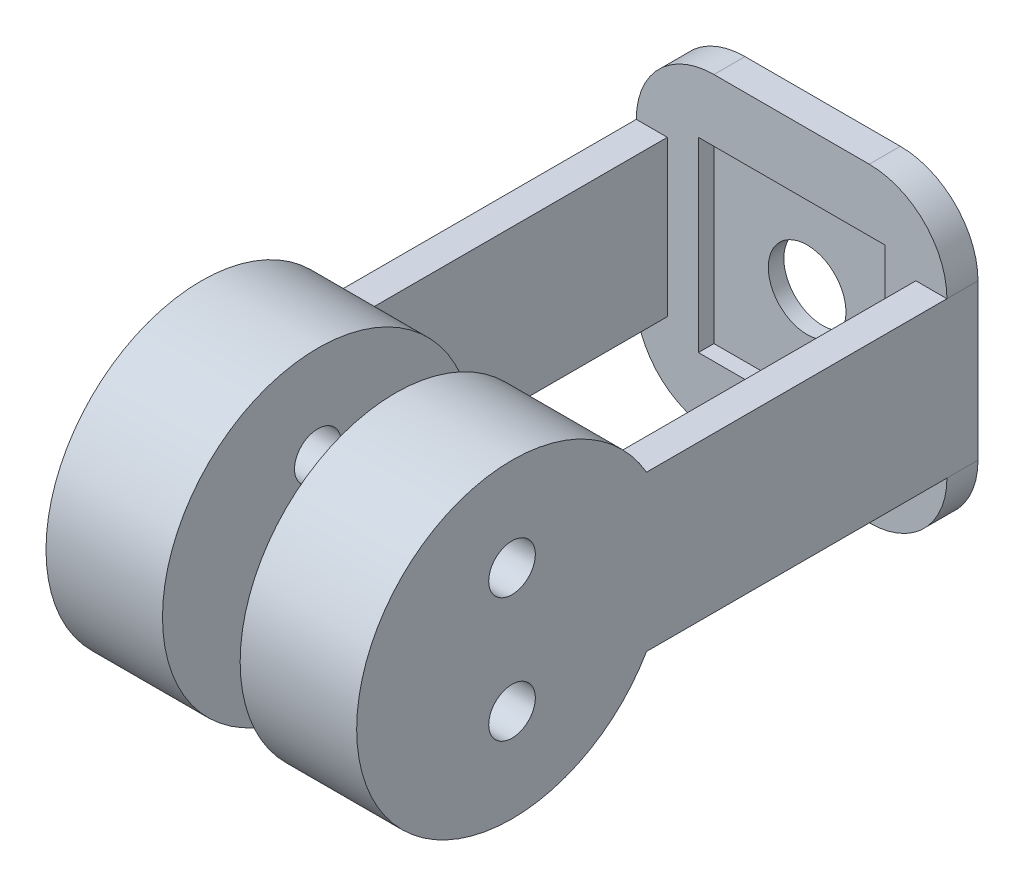
from build123d import *
from build123d.topology import SkipClean

# Parameters (mm, degrees)
SKETCH1_W           = 20
SKETCH1_H           = 20
BOSS_EXTRUDE1_DEPTH = 2
SKETCH3_R           = 2.5
CUT_EXTRUDE1_DEPTH  = 15.282857
SKETCH4_W           = 12
SKETCH4_H           = 12
CUT_EXTRUDE2_DEPTH  = 1
SKETCH5_W           = 2
SKETCH5_H           = 20
BOSS_EXTRUDE2_DEPTH = 38
CUT_EXTRUDE3_DEPTH  = 46.825757
SKETCH7_R           = 10
BOSS_EXTRUDE3_DEPTH = 7.5
BOSS_EXTRUDE4_START = -7.5
SKETCH8_R           = 10
BOSS_EXTRUDE4_DEPTH = 7.5
CUT_EXTRUDE4_DEPTH  = 46.825757
CUT_EXTRUDE5_DEPTH  = 46.825757
FILLET1_R           = 5
FILLET2_R           = 5
FILLET3_R           = 5
FILLET4_R           = 5


with BuildPart() as part:
    # Sketch1 → Boss-Extrude1 (new body)
    with BuildSketch(Plane.XY):
        Rectangle(SKETCH1_W, SKETCH1_H)
    extrude(amount=BOSS_EXTRUDE1_DEPTH)

    # Sketch3 → Cut-Extrude1 (cut, through all)
    with BuildSketch(Plane(origin=(0, 0, 0), x_dir=(-1, 0, 0), z_dir=(0, 0, -1))):
        Circle(SKETCH3_R)
    extrude(amount=-CUT_EXTRUDE1_DEPTH, mode=Mode.SUBTRACT)

    # Sketch4 → Cut-Extrude2 (cut)
    with BuildSketch(Plane.XY.offset(2)):
        Rectangle(SKETCH4_W, SKETCH4_H)
    extrude(amount=-CUT_EXTRUDE2_DEPTH, mode=Mode.SUBTRACT)

    # Sketch5 → Boss-Extrude2 (add)
    with BuildSketch(Plane.XY.offset(2)):
        with Locations((9, 0)):
            Rectangle(SKETCH5_W, SKETCH5_H)
        with Locations((-9, 0)):
            Rectangle(SKETCH5_W, SKETCH5_H)
    extrude(amount=BOSS_EXTRUDE2_DEPTH)

    # Sketch6 → Cut-Extrude3 (cut, through all)
    with BuildSketch(Plane.ZY.offset(10)):
        with BuildLine():
            Line((40, 10), (30, 10))
            ThreePointArc((30, 10), (37.071068, 7.071068), (40, 0))
            Line((40, 0), (40, 10))
        make_face()
        with BuildLine():
            Line((40, -10), (40, 0))
            ThreePointArc((40, 0), (37.071068, -7.071068), (30, -10))
            Line((30, -10), (40, -10))
        make_face()
    extrude(amount=-CUT_EXTRUDE3_DEPTH, mode=Mode.SUBTRACT)

    # Sketch7 → Boss-Extrude3 (add)
    with SkipClean():  # the faces are left unmerged after this step: merging them gives an invalid solid
        with BuildSketch(Plane.ZY.offset(10)):
            with Locations((30, 0)):
                Circle(SKETCH7_R)
        extrude(amount=-BOSS_EXTRUDE3_DEPTH)

    # Sketch8 → Boss-Extrude4 (add)
    with SkipClean():  # the faces are left unmerged after this step: merging them gives an invalid solid
        with BuildSketch(Plane(origin=(10, 0, 0), x_dir=(0, 0, -1), z_dir=(1, 0, 0)).offset(BOSS_EXTRUDE4_START)):
            with Locations(Location((-30, 0, 0), (0, 0, 180))):
                Circle(SKETCH8_R)
        extrude(amount=BOSS_EXTRUDE4_DEPTH)

    # Sketch9 → Cut-Extrude4 (cut, through all)
    with SkipClean():  # the faces are left unmerged after this step: merging them gives an invalid solid
        with BuildSketch(Plane.ZY.offset(10)):
            with BuildLine():
                ThreePointArc((31.5, 4), (31.06066, 5.06066), (30, 5.5))
                Line((30, 5.5), (30, 2.5))
                ThreePointArc((30, 2.5), (31.06066, 2.93934), (31.5, 4))
            make_face()
            with BuildLine():
                Line((30, 2.5), (30, 5.5))
                ThreePointArc((30, 5.5), (28.5, 4), (30, 2.5))
            make_face()
            with BuildLine():
                ThreePointArc((31.5, -4), (31.06066, -2.93934), (30, -2.5))
                Line((30, -2.5), (30, -5.5))
                ThreePointArc((30, -5.5), (31.06066, -5.06066), (31.5, -4))
            make_face()
            with BuildLine():
                Line((30, -5.5), (30, -2.5))
                ThreePointArc((30, -2.5), (28.5, -4), (30, -5.5))
            make_face()
        extrude(amount=-CUT_EXTRUDE4_DEPTH, mode=Mode.SUBTRACT)

    # Sketch11 → Cut-Extrude5 (cut, through all)
    with SkipClean():  # the faces are left unmerged after this step: merging them gives an invalid solid
        with BuildSketch(Plane(origin=(10, 0, 0), x_dir=(0, 0, -1), z_dir=(1, 0, 0))):
            with BuildLine():
                Line((-30, -10), (-2, -10))
                Line((-2, -10), (-2, -5))
                Line((-2, -5), (-21.339746, -5))
                ThreePointArc((-21.339746, -5), (-25, -8.660254), (-30, -10))
            make_face()
            with BuildLine():
                Line((-2, 10), (-30, 10))
                ThreePointArc((-30, 10), (-25, 8.660254), (-21.339746, 5))
                Line((-21.339746, 5), (-2, 5))
                Line((-2, 5), (-2, 10))
            make_face()
        extrude(amount=-CUT_EXTRUDE5_DEPTH, mode=Mode.SUBTRACT)

    # Fillet1
    fillet1_edges = [part.edges().sort_by_distance(p)[0] for p in [
        (-10, 10, 1),
    ]]
    fillet(fillet1_edges, radius=FILLET1_R)

    # Fillet2
    fillet2_edges = [part.edges().sort_by_distance(p)[0] for p in [
        (10, 10, 1),
    ]]
    fillet(fillet2_edges, radius=FILLET2_R)

    # Fillet3
    fillet3_edges = [part.edges().sort_by_distance(p)[0] for p in [
        (10, -10, 1),
    ]]
    fillet(fillet3_edges, radius=FILLET3_R)

    # Fillet4
    fillet4_edges = [part.edges().sort_by_distance(p)[0] for p in [
        (-10, -10, 1),
    ]]
    fillet(fillet4_edges, radius=FILLET4_R)


solid = part.part
